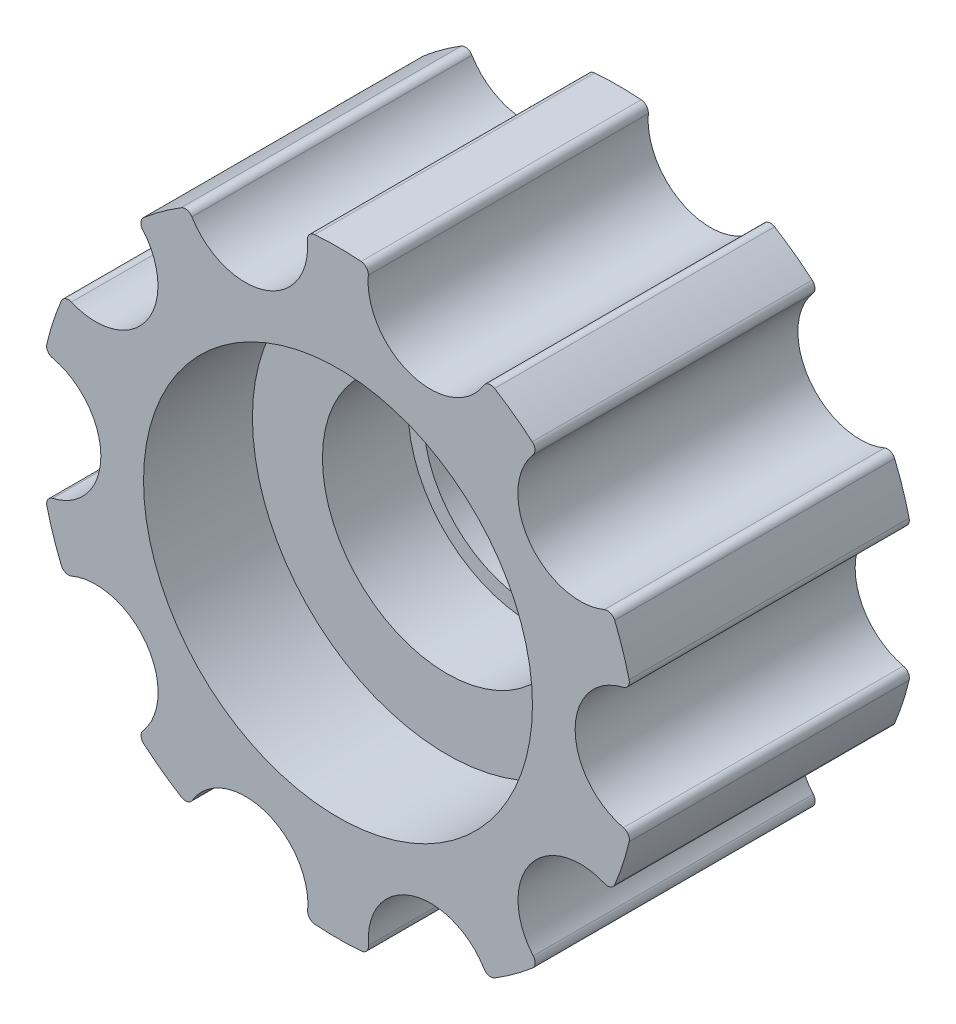
from build123d import *

# Parameters (mm, degrees)
SPROKET_DEPTH       = 9
SKETCH3_R           = 12.5
CUT_EXTRUDE1_DEPTH  = 7
SKETCH4_R           = 10
SKETCH4_R_2         = 7
BOSS_EXTRUDE1_DEPTH = 7
SKETCH5_R           = 8
CUT_EXTRUDE2_DEPTH  = 5.5


with BuildPart() as part:
    # Sprocket → Sproket (new body)
    with BuildSketch(Plane(origin=(-521.333895642, -864.335014518, -1401.843992528), x_dir=(1, 0, 0), z_dir=(0, 0, 1))):
        with BuildLine():
            ThreePointArc((502.621153074, 859.818847383), (503.02864119, 858.378492088), (503.546815178, 856.974153932))
            ThreePointArc((503.546815178, 856.974153932), (503.819037022, 856.702761655), (504.203425444, 856.704771932))
            ThreePointArc((504.203425444, 856.704771932), (509.005673001, 855.369858884), (508.795597259, 850.389955006))
            ThreePointArc((508.795597259, 850.389955006), (508.675219652, 850.024896474), (508.849505331, 849.682284445))
            ThreePointArc((508.849505331, 849.682284445), (510.025789743, 848.756528039), (511.270450563, 847.924969632))
            ThreePointArc((511.270450563, 847.924969632), (511.650203039, 847.865416653), (511.959998194, 848.092980848))
            ThreePointArc((511.959998194, 848.092980848), (516.629740281, 849.835703798), (519.386899492, 845.683397507))
            ThreePointArc((519.386899492, 845.683397507), (519.504087984, 845.317302769), (519.846470359, 845.142566367))
            ThreePointArc((519.846470359, 845.142566367), (521.342250401, 845.085016331), (522.837979924, 845.143864722))
            ThreePointArc((522.837979924, 845.143864722), (523.180210493, 845.318898255), (523.297081161, 845.685094579))
            ThreePointArc((523.297081161, 845.685094579), (526.05063502, 849.839792593), (530.721888079, 848.101123761))
            ThreePointArc((530.721888079, 848.101123761), (531.031880649, 847.873828563), (531.411581288, 847.933711155))
            ThreePointArc((531.411581288, 847.933711155), (532.655519825, 848.766349647), (533.831000211, 849.693126751))
            ThreePointArc((533.831000211, 849.693126751), (534.004988429, 850.035889936), (533.884293987, 850.400843839))
            ThreePointArc((533.884293987, 850.400843839), (533.669895633, 855.380563489), (538.470982641, 856.719644514))
            ThreePointArc((538.470982641, 856.719644514), (538.855372663, 856.717967897), (539.127358829, 856.989596368))
            ThreePointArc((539.127358829, 856.989596368), (539.644313618, 858.394383784), (540.050551314, 859.835092247))
            ThreePointArc((540.050551314, 859.835092247), (539.989839594, 860.214661197), (539.677681217, 860.438972694))
            ThreePointArc((539.677681217, 860.438972694), (536.577223534, 864.341630328), (539.674292437, 868.246977772))
            ThreePointArc((539.674292437, 868.246977772), (539.986255988, 868.471560146), (540.046638209, 868.851181652))
            ThreePointArc((540.046638209, 868.851181652), (539.639150093, 870.291536947), (539.120976106, 871.695875104))
            ThreePointArc((539.120976106, 871.695875104), (538.848754261, 871.967267381), (538.464365839, 871.965257104))
            ThreePointArc((538.464365839, 871.965257104), (533.662118282, 873.300170152), (533.872194024, 878.280074029))
            ThreePointArc((533.872194024, 878.280074029), (533.992571631, 878.645132562), (533.818285952, 878.98774459))
            ThreePointArc((533.818285952, 878.98774459), (532.642001541, 879.913500997), (531.39734072, 880.745059403))
            ThreePointArc((531.39734072, 880.745059403), (531.017588244, 880.804612382), (530.70779309, 880.577048188))
            ThreePointArc((530.70779309, 880.577048188), (526.038051002, 878.834325238), (523.280891791, 882.986631528))
            ThreePointArc((523.280891791, 882.986631528), (523.163703299, 883.352726267), (522.821320924, 883.527462669))
            ThreePointArc((522.821320924, 883.527462669), (521.325540883, 883.585012705), (519.829811359, 883.526164313))
            ThreePointArc((519.829811359, 883.526164313), (519.48758079, 883.35113078), (519.370710122, 882.984934457))
            ThreePointArc((519.370710122, 882.984934457), (516.617156263, 878.830236442), (511.945903204, 880.568905275))
            ThreePointArc((511.945903204, 880.568905275), (511.635910634, 880.796200472), (511.256209995, 880.736317881))
            ThreePointArc((511.256209995, 880.736317881), (510.012271459, 879.903679389), (508.836791072, 878.976902284))
            ThreePointArc((508.836791072, 878.976902284), (508.662802855, 878.6341391), (508.783497297, 878.269185196))
            ThreePointArc((508.783497297, 878.269185196), (508.99789565, 873.289465546), (504.196808642, 871.950384521))
            ThreePointArc((504.196808642, 871.950384521), (503.81241862, 871.952061138), (503.540432454, 871.680432668))
            ThreePointArc((503.540432454, 871.680432668), (503.023477665, 870.275645251), (502.617239969, 868.834936788))
            ThreePointArc((502.617239969, 868.834936788), (502.677951689, 868.455367839), (502.990110067, 868.231056341))
            ThreePointArc((502.990110067, 868.231056341), (506.090567749, 864.328398708), (502.993498846, 860.423051264))
            ThreePointArc((502.993498846, 860.423051264), (502.681535295, 860.198468889), (502.621153074, 859.818847383))
        make_face()
    sproket = extrude(amount=SPROKET_DEPTH)

    # Sketch3 → Cut-Extrude1 (cut)
    with BuildSketch(Plane.XY.offset(-1392.843992528)):
        Circle(SKETCH3_R)
    cut_extrude1 = extrude(amount=-CUT_EXTRUDE1_DEPTH, mode=Mode.SUBTRACT)

    # Mirror1: Sproket, Cut-Extrude1 across plane
    add(sproket.mirror(Plane(origin=(9.113348653, 2.199432046, -1401.843992528), x_dir=(1, 0, 0), z_dir=(0, 0, 1))))
    add(cut_extrude1.mirror(Plane(origin=(9.113348653, 2.199432046, -1401.843992528), x_dir=(1, 0, 0), z_dir=(0, 0, 1))), mode=Mode.SUBTRACT)

    # Sketch4 → Boss-Extrude1 (add)
    with BuildSketch(Plane(origin=(0, 0, -1403.843992528), x_dir=(-1, 0, 0), z_dir=(0, 0, -1))):
        Circle(SKETCH4_R)
        Circle(SKETCH4_R_2, mode=Mode.SUBTRACT)
    extrude(amount=BOSS_EXTRUDE1_DEPTH)

    # Sketch5 → Cut-Extrude2 (cut)
    with BuildSketch(Plane.XY.offset(-1399.843992528)):
        Circle(SKETCH5_R)
    extrude(amount=-CUT_EXTRUDE2_DEPTH, mode=Mode.SUBTRACT)


solid = part.part
